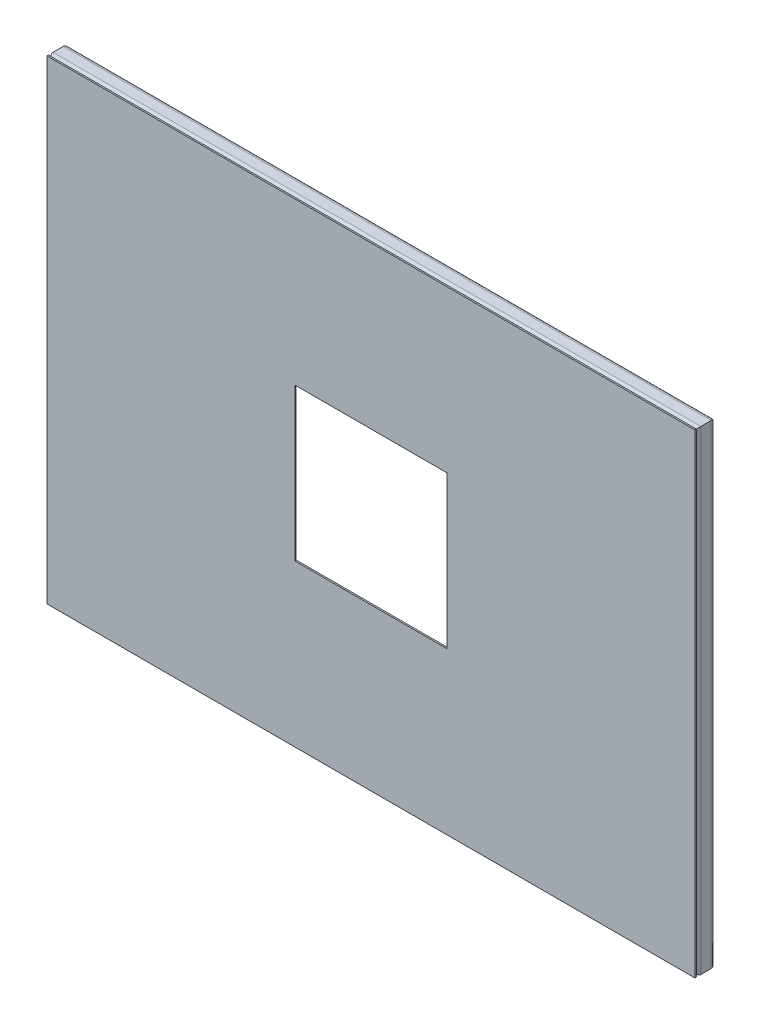
from build123d import *

# Parameters (mm, degrees)
TUBO_CUADRADO_2_X_2_X_0_25_1_DEPTH      = 605.819481564
TUBO_CUADRADO_2_X_2_X_0_25_1_DEPTH_BACK = 33.319481564
TUBO_CUADRADO_2_X_2_X_0_25_1_2_DEPTH    = 866.638963129
TUBO_CUADRADO_2_X_2_X_0_25_1_3_DEPTH    = 639.138963129
TUBO_CUADRADO_2_X_2_X_0_25_1_4_DEPTH    = 866.638963129
CROQUIS3_W                              = 850.8
CROQUIS3_H                              = 623.3
SALIENTE_EXTRUIR1_DEPTH                 = 1.9
CROQUIS4_W                              = 200
CROQUIS4_H                              = 200
CORTAR_EXTRUIR2_DEPTH                   = 10


with BuildPart() as part:
    # Sketch1 → Tubo cuadrado 2 X 2 X 0.25(1) (new, two sides: drawn at the far end of the back side and taken through both)
    with BuildSketch(Plane(origin=(-412.7, 286.25, -6.7), x_dir=(1, 0, 0), z_dir=(0, -1, 0)).offset(-TUBO_CUADRADO_2_X_2_X_0_25_1_DEPTH_BACK)):
        with BuildLine():
            Line((-6.7, -12.7), (6.7, -12.7))
            ThreePointArc((6.7, -12.7), (10.942640687, -10.942640687), (12.7, -6.7))
            Line((12.7, -6.7), (12.7, 6.7))
            ThreePointArc((12.7, 6.7), (10.942640687, 10.942640687), (6.7, 12.7))
            Line((6.7, 12.7), (-6.7, 12.7))
            ThreePointArc((-6.7, 12.7), (-10.942640687, 10.942640687), (-12.7, 6.7))
            Line((-12.7, 6.7), (-12.7, -6.7))
            ThreePointArc((-12.7, -6.7), (-10.942640687, -10.942640687), (-6.7, -12.7))
        make_face()
        with BuildLine():
            Line((-6.7, -9.7), (6.7, -9.7))
            ThreePointArc((6.7, -9.7), (8.821320344, -8.821320344), (9.7, -6.7))
            Line((9.7, -6.7), (9.7, 6.7))
            ThreePointArc((9.7, 6.7), (8.821320344, 8.821320344), (6.7, 9.7))
            Line((6.7, 9.7), (-6.7, 9.7))
            ThreePointArc((-6.7, 9.7), (-8.821320344, 8.821320344), (-9.7, 6.7))
            Line((-9.7, 6.7), (-9.7, -6.7))
            ThreePointArc((-9.7, -6.7), (-8.821320344, -8.821320344), (-6.7, -9.7))
        make_face(mode=Mode.SUBTRACT)
    extrude(amount=TUBO_CUADRADO_2_X_2_X_0_25_1_DEPTH + TUBO_CUADRADO_2_X_2_X_0_25_1_DEPTH_BACK)

    # Tubo cuadrado 2 X 2 X 0.25(1) mitre 1
    split(bisect_by=Plane(origin=(-400, 286.25, 0), x_dir=(0.707106781, -0.707106781, 0), z_dir=(-0.707106781, -0.707106781, 0)), keep=Keep.TOP)

    # Tubo cuadrado 2 X 2 X 0.25(1) mitre 2
    split(bisect_by=Plane(origin=(-400, -286.25, 0), x_dir=(-0.707106781, -0.707106781, 0), z_dir=(-0.707106781, 0.707106781, 0)), keep=Keep.TOP)


with BuildPart() as body_2:
    # Sketch1 on segment 2 (carried to segment 2) → Tubo cuadrado 2 X 2 X 0.25_1 2 (new body)
    with BuildSketch(Plane(origin=(-433.319481564, -298.95, -6.7), x_dir=(0, 1, 0), z_dir=(1, 0, 0))):
        with BuildLine():
            Line((-6.7, -12.7), (6.7, -12.7))
            ThreePointArc((6.7, -12.7), (10.942640687, -10.942640687), (12.7, -6.7))
            Line((12.7, -6.7), (12.7, 6.7))
            ThreePointArc((12.7, 6.7), (10.942640687, 10.942640687), (6.7, 12.7))
            Line((6.7, 12.7), (-6.7, 12.7))
            ThreePointArc((-6.7, 12.7), (-10.942640687, 10.942640687), (-12.7, 6.7))
            Line((-12.7, 6.7), (-12.7, -6.7))
            ThreePointArc((-12.7, -6.7), (-10.942640687, -10.942640687), (-6.7, -12.7))
        make_face()
        with BuildLine():
            Line((-6.7, -9.7), (6.7, -9.7))
            ThreePointArc((6.7, -9.7), (8.821320344, -8.821320344), (9.7, -6.7))
            Line((9.7, -6.7), (9.7, 6.7))
            ThreePointArc((9.7, 6.7), (8.821320344, 8.821320344), (6.7, 9.7))
            Line((6.7, 9.7), (-6.7, 9.7))
            ThreePointArc((-6.7, 9.7), (-8.821320344, 8.821320344), (-9.7, 6.7))
            Line((-9.7, 6.7), (-9.7, -6.7))
            ThreePointArc((-9.7, -6.7), (-8.821320344, -8.821320344), (-6.7, -9.7))
        make_face(mode=Mode.SUBTRACT)
    extrude(amount=TUBO_CUADRADO_2_X_2_X_0_25_1_2_DEPTH)

    # Tubo cuadrado 2 X 2 X 0.25_1 2 mitre 1
    split(bisect_by=Plane(origin=(-400, -286.25, 0), x_dir=(0.707106781, 0.707106781, 0), z_dir=(0.707106781, -0.707106781, 0)), keep=Keep.TOP)

    # Tubo cuadrado 2 X 2 X 0.25_1 2 mitre 2
    split(bisect_by=Plane(origin=(400, -286.25, 0), x_dir=(0.707106781, -0.707106781, 0), z_dir=(-0.707106781, -0.707106781, 0)), keep=Keep.TOP)


with BuildPart() as body_3:
    # Sketch1 on segment 3 (carried to segment 3) → Tubo cuadrado 2 X 2 X 0.25_1 3 (new body)
    with BuildSketch(Plane(origin=(412.7, -319.569481564, -6.7), x_dir=(-1, 0, 0), z_dir=(0, 1, 0))):
        with BuildLine():
            Line((-6.7, -12.7), (6.7, -12.7))
            ThreePointArc((6.7, -12.7), (10.942640687, -10.942640687), (12.7, -6.7))
            Line((12.7, -6.7), (12.7, 6.7))
            ThreePointArc((12.7, 6.7), (10.942640687, 10.942640687), (6.7, 12.7))
            Line((6.7, 12.7), (-6.7, 12.7))
            ThreePointArc((-6.7, 12.7), (-10.942640687, 10.942640687), (-12.7, 6.7))
            Line((-12.7, 6.7), (-12.7, -6.7))
            ThreePointArc((-12.7, -6.7), (-10.942640687, -10.942640687), (-6.7, -12.7))
        make_face()
        with BuildLine():
            Line((-6.7, -9.7), (6.7, -9.7))
            ThreePointArc((6.7, -9.7), (8.821320344, -8.821320344), (9.7, -6.7))
            Line((9.7, -6.7), (9.7, 6.7))
            ThreePointArc((9.7, 6.7), (8.821320344, 8.821320344), (6.7, 9.7))
            Line((6.7, 9.7), (-6.7, 9.7))
            ThreePointArc((-6.7, 9.7), (-8.821320344, 8.821320344), (-9.7, 6.7))
            Line((-9.7, 6.7), (-9.7, -6.7))
            ThreePointArc((-9.7, -6.7), (-8.821320344, -8.821320344), (-6.7, -9.7))
        make_face(mode=Mode.SUBTRACT)
    extrude(amount=TUBO_CUADRADO_2_X_2_X_0_25_1_3_DEPTH)

    # Tubo cuadrado 2 X 2 X 0.25_1 3 mitre 1
    split(bisect_by=Plane(origin=(400, 286.25, 0), x_dir=(0.707106781, 0.707106781, 0), z_dir=(0.707106781, -0.707106781, 0)), keep=Keep.TOP)

    # Tubo cuadrado 2 X 2 X 0.25_1 3 mitre 2
    split(bisect_by=Plane(origin=(400, -286.25, 0), x_dir=(-0.707106781, 0.707106781, 0), z_dir=(0.707106781, 0.707106781, 0)), keep=Keep.TOP)


with BuildPart() as body_4:
    # Sketch1 on segment 4 (carried to segment 4) → Tubo cuadrado 2 X 2 X 0.25_1 4 (new body)
    with BuildSketch(Plane(origin=(433.319481564, 298.95, -6.7), x_dir=(0, -1, 0), z_dir=(-1, 0, 0))):
        with BuildLine():
            Line((-6.7, -12.7), (6.7, -12.7))
            ThreePointArc((6.7, -12.7), (10.942640687, -10.942640687), (12.7, -6.7))
            Line((12.7, -6.7), (12.7, 6.7))
            ThreePointArc((12.7, 6.7), (10.942640687, 10.942640687), (6.7, 12.7))
            Line((6.7, 12.7), (-6.7, 12.7))
            ThreePointArc((-6.7, 12.7), (-10.942640687, 10.942640687), (-12.7, 6.7))
            Line((-12.7, 6.7), (-12.7, -6.7))
            ThreePointArc((-12.7, -6.7), (-10.942640687, -10.942640687), (-6.7, -12.7))
        make_face()
        with BuildLine():
            Line((-6.7, -9.7), (6.7, -9.7))
            ThreePointArc((6.7, -9.7), (8.821320344, -8.821320344), (9.7, -6.7))
            Line((9.7, -6.7), (9.7, 6.7))
            ThreePointArc((9.7, 6.7), (8.821320344, 8.821320344), (6.7, 9.7))
            Line((6.7, 9.7), (-6.7, 9.7))
            ThreePointArc((-6.7, 9.7), (-8.821320344, 8.821320344), (-9.7, 6.7))
            Line((-9.7, 6.7), (-9.7, -6.7))
            ThreePointArc((-9.7, -6.7), (-8.821320344, -8.821320344), (-6.7, -9.7))
        make_face(mode=Mode.SUBTRACT)
    extrude(amount=TUBO_CUADRADO_2_X_2_X_0_25_1_4_DEPTH)

    # Tubo cuadrado 2 X 2 X 0.25_1 4 mitre 1
    split(bisect_by=Plane(origin=(-400, 286.25, 0), x_dir=(-0.707106781, 0.707106781, 0), z_dir=(0.707106781, 0.707106781, 0)), keep=Keep.TOP)

    # Tubo cuadrado 2 X 2 X 0.25_1 4 mitre 2
    split(bisect_by=Plane(origin=(400, 286.25, 0), x_dir=(-0.707106781, -0.707106781, 0), z_dir=(-0.707106781, 0.707106781, 0)), keep=Keep.TOP)


with BuildPart() as body_5:
    # Croquis3 → Saliente-Extruir1 (new body)
    with BuildSketch(Plane.XY.offset(6)):
        Rectangle(CROQUIS3_W, CROQUIS3_H)
    extrude(amount=SALIENTE_EXTRUIR1_DEPTH)

    # Croquis4 → Cortar-Extruir2 (cut)
    with BuildSketch(Plane.XY.offset(7.9)):
        Rectangle(CROQUIS4_W, CROQUIS4_H)
    extrude(amount=-CORTAR_EXTRUIR2_DEPTH, mode=Mode.SUBTRACT)


solid = Compound([part.part, body_2.part, body_3.part, body_4.part, body_5.part])
